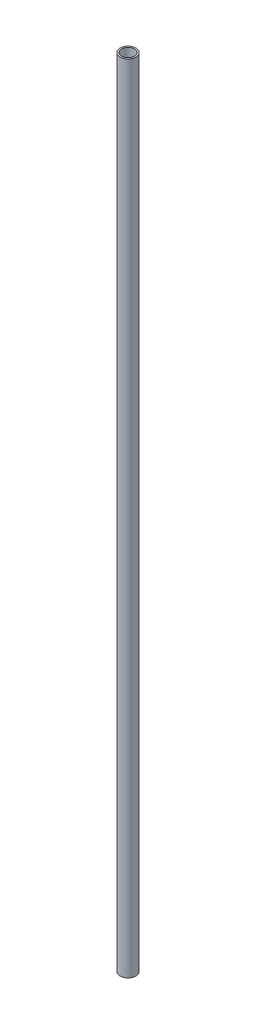
from build123d import *

# Parameters (mm, degrees)
SKETCH_1_R      = 2.5
SKETCH_1_R_2    = 2
EXTRUDE_1_DEPTH = 250


with BuildPart() as part:
    # 草图1 → 凸台-拉伸1 (new body)
    with BuildSketch(Plane(origin=(0, 0, 0), x_dir=(1, 0, 0), z_dir=(0, 1, 0))):
        with Locations(Location((0, 0, 0), (0, 0, 270))):
            Circle(SKETCH_1_R)
        with Locations(Location((0, 0, 0), (0, 0, 270))):
            Circle(SKETCH_1_R_2, mode=Mode.SUBTRACT)
    extrude(amount=EXTRUDE_1_DEPTH)


solid = part.part
